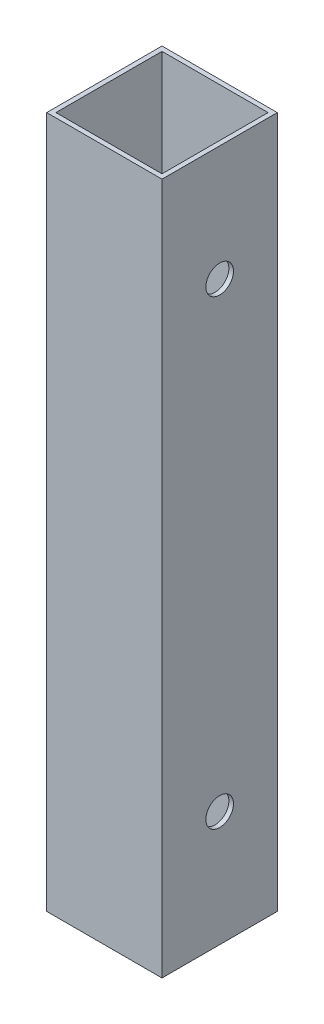
from build123d import *

# Parameters (mm, degrees)
SKETCH1_W           = 25
SKETCH1_H           = 25
SKETCH1_W_2         = 23
SKETCH1_H_2         = 23
BOSS_EXTRUDE1_DEPTH = 150
SKETCH2_R           = 3
CUT_EXTRUDE1_DEPTH  = 153.581945197


with BuildPart() as part:
    # Sketch1 → Boss-Extrude1 (new body)
    with BuildSketch(Plane(origin=(0, 0, 0), x_dir=(1, 0, 0), z_dir=(0, 1, 0))):
        Rectangle(SKETCH1_W, SKETCH1_H)
        Rectangle(SKETCH1_W_2, SKETCH1_H_2, mode=Mode.SUBTRACT)
    extrude(amount=BOSS_EXTRUDE1_DEPTH)

    # Sketch2 → Cut-Extrude1 (cut, through all)
    with BuildSketch(Plane(origin=(12.5, 0, 0), x_dir=(0, 0, -1), z_dir=(1, 0, 0))):
        with Locations((0, 125)):
            Circle(SKETCH2_R)
        with Locations((0, 25)):
            Circle(SKETCH2_R)
    extrude(amount=-CUT_EXTRUDE1_DEPTH, mode=Mode.SUBTRACT)


solid = part.part
